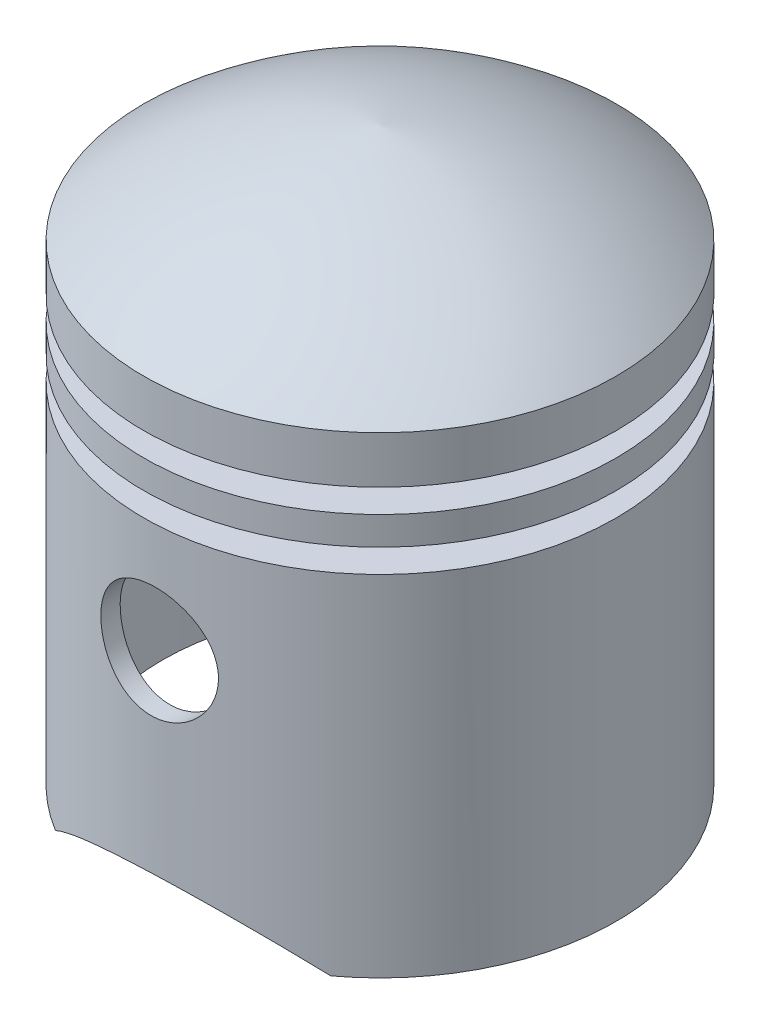
from build123d import *

# Parameters (mm, degrees)
CUT_EXTRUDE2_DEPTH      = 73.661751058
CUT_EXTRUDE2_DEPTH_BACK = 73.661751058
SKETCH2_R               = 6
BOSS_EXTRUDE12_START    = -15
SKETCH5_R               = 7
BOSS_EXTRUDE12_DEPTH    = 10
SKETCH8_R               = 4.429949132
CUT_EXTRUDE17_DEPTH     = 65


with BuildPart() as part:
    # Sketch1 → Revolve1 (revolve)
    with BuildSketch(Plane.XY, mode=Mode.PRIVATE) as revolve1_sk:
        with BuildLine():
            Line((31.535377647, 0), (31.535377647, 37))
            Line((31.535377647, 37), (26.428736502, 37))
            Line((26.428736502, 37), (26.428736502, 39.5))
            Line((26.428736502, 39.5), (31.535377647, 39.5))
            Line((31.535377647, 39.5), (31.535377647, 42.5))
            Line((31.535377647, 42.5), (26.428736502, 42.5))
            Line((26.428736502, 42.5), (26.428736502, 45))
            Line((26.428736502, 45), (31.535377647, 45))
            Line((31.535377647, 45), (31.535377647, 50))
            ThreePointArc((31.535377647, 50), (19.773454106, 57.007324902), (6.535377647, 60.5))
            Line((6.535377647, 60.5), (6.535377647, 58.485322825))
            ThreePointArc((6.535377647, 58.485322825), (18.669730587, 55.300187699), (29.535377647, 49.029197266))
            Line((29.535377647, 49.029197266), (29.535377647, 47))
            Line((29.535377647, 47), (24.428736502, 47))
            Line((24.428736502, 47), (24.428736502, 41))
            Line((24.428736502, 41), (24.428736502, 35))
            Line((24.428736502, 35), (29.535377647, 35))
            Line((29.535377647, 35), (29.535377647, 0))
            Line((29.535377647, 0), (31.535377647, 0))
        make_face()
    revolve(revolve1_sk.sketch.rotate(Axis((6.535377647, 60.5, 0), (0, -1, 0)), 180), axis=Axis((6.535377647, 60.5, 0), (0, -1, 0)))

    # Sketch2 → Cut-Extrude2 (cut, two sides: drawn at the far end of the back side and taken through both)
    with BuildSketch(Plane.XY.offset(-CUT_EXTRUDE2_DEPTH_BACK)):
        with Locations((7.458608079, 25.248507494)):
            Circle(SKETCH2_R)
        with BuildLine():
            Line((-6.490236288, 0), (21.407452446, 0))
            ThreePointArc((21.407452446, 0), (7.458608079, 4.836309849), (-6.490236288, 0))
        make_face()
    extrude(amount=CUT_EXTRUDE2_DEPTH + CUT_EXTRUDE2_DEPTH_BACK, mode=Mode.SUBTRACT)


with BuildPart() as body_2:
    # Sketch5 → Boss-Extrude12 (new, through all)
    with BuildSketch(Plane.XY.offset(BOSS_EXTRUDE12_START)):
        with Locations((7.458608079, 25.248507494)):
            Circle(SKETCH5_R)
    extrude(amount=-BOSS_EXTRUDE12_DEPTH)

    # Sketch8 → Cut-Extrude17 (cut)
    with BuildSketch(Plane.XY):
        with Locations((7.458608079, 25.248507494)):
            Circle(SKETCH8_R)
    extrude(amount=-CUT_EXTRUDE17_DEPTH, mode=Mode.SUBTRACT)


solid = Compound([part.part, body_2.part])
